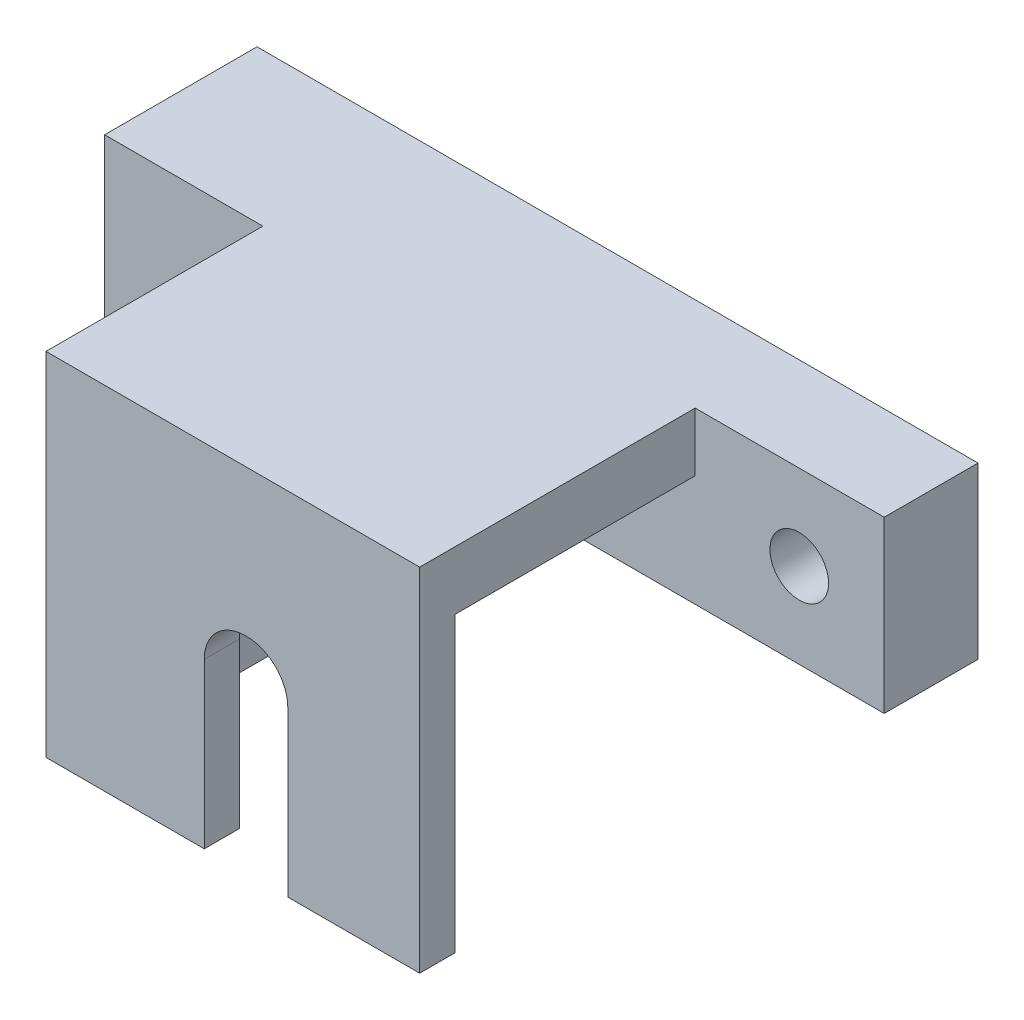
from build123d import *

# Parameters (mm, degrees)
SKIZZE1_W                       = 24.6
SKIZZE1_H                       = 5.8
SKIZZE1_R                       = 1
AUFSATZ_LINEAR_AUSTRAGEN1_DEPTH = 3.2
SKIZZE2_W                       = 6.2
SKIZZE2_H                       = 12
AUFSATZ_LINEAR_AUSTRAGEN2_DEPTH = 2
SKIZZE3_R                       = 1
SCHNITT_LINEAR_AUSTRAGEN1_DEPTH = 2
AUFSATZ_LINEAR_AUSTRAGEN3_DEPTH = 8.2
SKIZZE5_W                       = 5.4
SKIZZE5_H                       = 1.2
AUFSATZ_LINEAR_AUSTRAGEN4_DEPTH = 12
SKIZZE6_W                       = 4.6
SKIZZE6_H                       = 8.2
SCHNITT_LINEAR_AUSTRAGEN2_DEPTH = 3.8
AUFSATZ_LINEAR_AUSTRAGEN5_DEPTH = 2.85
AUFSATZ_LINEAR_AUSTRAGEN6_DEPTH = 4.5
VERRUNDUNG1_R                   = 1.4


with BuildPart() as part:
    # Skizze1 → Aufsatz-Linear austragen1 (new body)
    with BuildSketch(Plane.XY):
        with Locations((12.3, 2.9)):
            Rectangle(SKIZZE1_W, SKIZZE1_H)
        with Locations((21.7, 2.9)):
            Circle(SKIZZE1_R, mode=Mode.SUBTRACT)
    extrude(amount=AUFSATZ_LINEAR_AUSTRAGEN1_DEPTH)

    # Skizze2 → Aufsatz-Linear austragen2 (add)
    with BuildSketch(Plane.XY.offset(3.2)):
        with Locations((3.1, -0.2)):
            Rectangle(SKIZZE2_W, SKIZZE2_H)
    extrude(amount=AUFSATZ_LINEAR_AUSTRAGEN2_DEPTH)

    # Skizze3 → Schnitt-Linear austragen1 (cut)
    with BuildSketch(Plane(origin=(0, 0, 3.2), x_dir=(-1, 0, 0), z_dir=(0, 0, -1))):
        with Locations((-2.7, -3.1)):
            Circle(SKIZZE3_R)
    extrude(amount=-SCHNITT_LINEAR_AUSTRAGEN1_DEPTH, mode=Mode.SUBTRACT)

    # Skizze4 → Aufsatz-Linear austragen3 (add)
    with BuildSketch(Plane.XY.offset(3.2)):
        Polygon((6.2, 5.8), (10.8, 5.8), (10.8, 0), (6.2, 0), (6.2, -6.2), (5.4, -6.2), (5.4, 5.8), align=None)
    extrude(amount=AUFSATZ_LINEAR_AUSTRAGEN3_DEPTH)

    # Skizze5 → Aufsatz-Linear austragen4 (add)
    with BuildSketch(Plane(origin=(0, 5.8, 0), x_dir=(1, 0, 0), z_dir=(0, 1, 0))):
        with Locations((8.1, -12)):
            Rectangle(SKIZZE5_W, SKIZZE5_H)
    extrude(amount=-AUFSATZ_LINEAR_AUSTRAGEN4_DEPTH)

    # Skizze6 → Schnitt-Linear austragen2 (cut)
    with BuildSketch(Plane.XZ):
        with Locations((8.5, 7.3)):
            Rectangle(SKIZZE6_W, SKIZZE6_H)
    extrude(amount=-SCHNITT_LINEAR_AUSTRAGEN2_DEPTH, mode=Mode.SUBTRACT)

    # Skizze7 → Aufsatz-Linear austragen5 (add)
    with BuildSketch(Plane(origin=(10.8, 0, 0), x_dir=(0, 0, -1), z_dir=(1, 0, 0))):
        Polygon((-12.6, 5.8), (-12.6, 0.8), (-11.4, 0.8), (-11.4, 3.8), (-3.2, 3.8), (-3.2, 5.8), align=None)
    extrude(amount=AUFSATZ_LINEAR_AUSTRAGEN5_DEPTH)

    # Skizze8 → Aufsatz-Linear austragen6 (add)
    with BuildSketch(Plane(origin=(13.65, 0, 0), x_dir=(0, 0, -1), z_dir=(1, 0, 0))):
        Polygon((-3.2, 5.8), (-12.6, 5.8), (-12.6, -6.2), (-11.4, -6.2), (-11.4, 3.8), (-3.2, 3.8), align=None)
    extrude(amount=AUFSATZ_LINEAR_AUSTRAGEN6_DEPTH)

    # Verrundung1
    verrundung1_edges = [part.edges().sort_by_distance(p)[0] for p in [
        (13.65, 0.8, 12),
        (10.8, 0.8, 12),
    ]]
    fillet(verrundung1_edges, radius=VERRUNDUNG1_R)


solid = part.part
